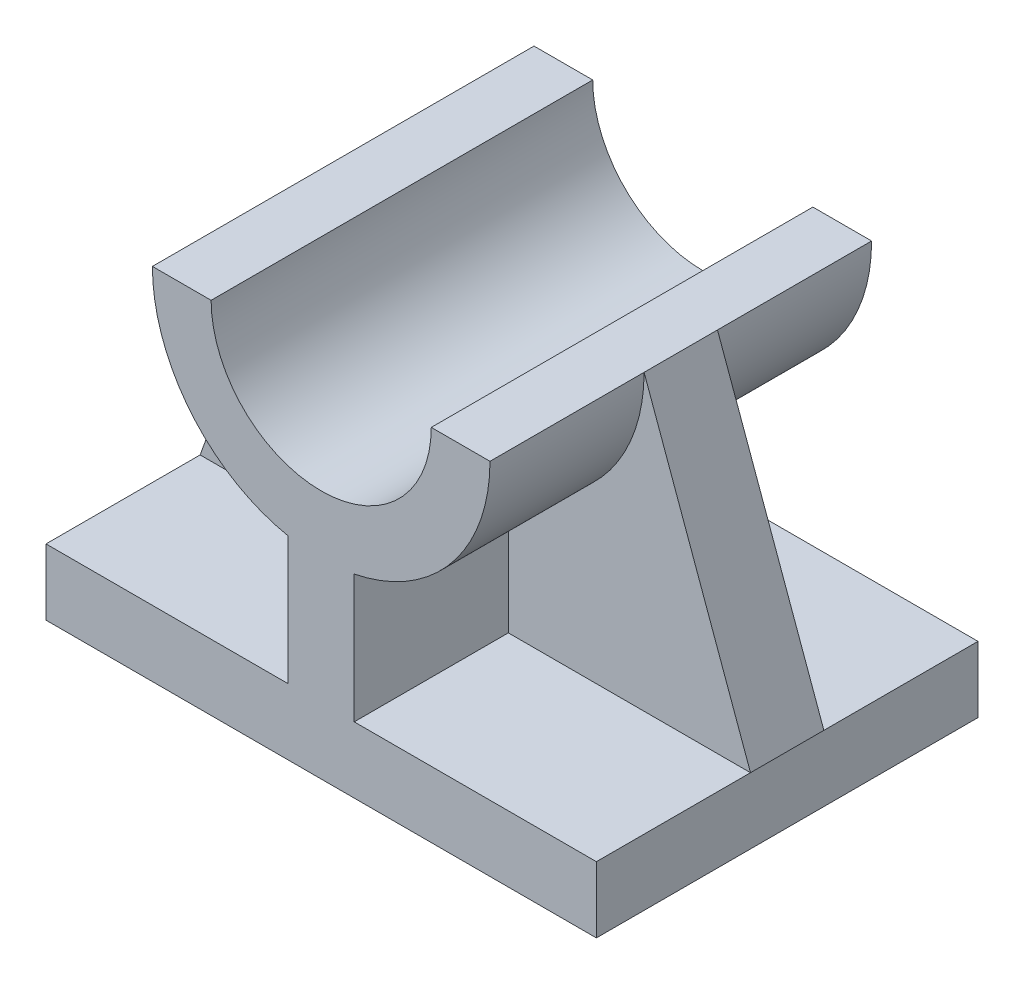
from build123d import *

# Parameters (mm, degrees)
BOSS_EXTRUDE2_DEPTH = 26
RIB1_REACH          = 65.738
SKETCH2_WALL_W      = 172.022520638
SKETCH2_WALL_H      = 10


with BuildPart() as part:
    # Sketch1 → Boss-Extrude2 (new, symmetric)
    with BuildSketch(Plane.XY):
        with BuildLine():
            Line((-23, 44.5), (-15, 44.5))
            ThreePointArc((-15, 44.5), (0, 29.5), (15, 44.5))
            Line((15, 44.5), (23, 44.5))
            ThreePointArc((23, 44.5), (17.783419244, 29.914047854), (4.5, 21.944512863))
            Line((4.5, 21.944512863), (4.5, 4.5))
            Line((4.5, 4.5), (37.5, 4.5))
            Line((37.5, 4.5), (37.5, -4.5))
            Line((37.5, -4.5), (-37.5, -4.5))
            Line((-37.5, -4.5), (-37.5, 4.5))
            Line((-37.5, 4.5), (-4.5, 4.5))
            Line((-4.5, 4.5), (-4.5, 21.944512863))
            ThreePointArc((-4.5, 21.944512863), (-17.783419244, 29.914047854), (-23, 44.5))
        make_face()
    extrude(amount=BOSS_EXTRUDE2_DEPTH, both=True)

    # Sketch2 wall → Rib1 (add, up to next)
    with BuildSketch(Plane(origin=(30.25, 24.5, 0), x_dir=(0.340799323621, -0.940136065162, 0), z_dir=(0.940136065162, 0.340799323621, 0)), mode=Mode.PRIVATE) as rib1_sk1:
        Rectangle(SKETCH2_WALL_W, SKETCH2_WALL_H)
    rib1_tool1 = extrude(rib1_sk1.sketch, amount=-RIB1_REACH, mode=Mode.PRIVATE) - part.part
    rib1 = rib1_tool1.solids().sort_by_distance((30.25, 24.5, 0))[0]
    add(rib1)

    # Mirror1: Rib1 across plane
    add(rib1.mirror(Plane(origin=(0, 0, 0), x_dir=(0, 0, 1), z_dir=(1, 0, 0))))


solid = part.part
